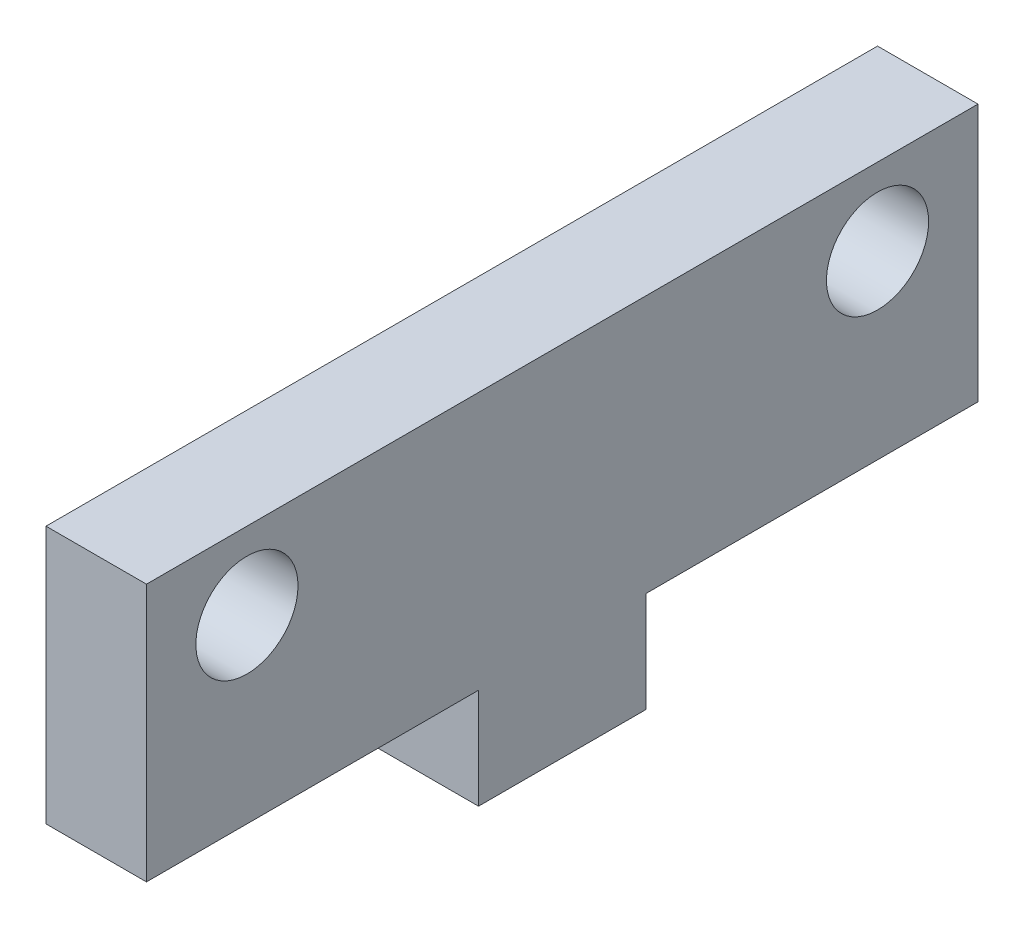
from build123d import *

# Parameters (mm, degrees)
SKETCH1_R           = 1.525
BOSS_EXTRUDE1_DEPTH = 3


with BuildPart() as part:
    # Sketch1 → Boss-Extrude1 (new body)
    with BuildSketch(Plane(origin=(0, 0, 0), x_dir=(0, 0, -1), z_dir=(1, 0, 0))):
        Polygon((0, 0), (-9.915, 0), (-9.915, -3), (-14.915, -3), (-14.915, 0), (-24.83, 0), (-24.83, 7.7), (0, 7.7), align=None)
        with Locations((-21.83, 5.4)):
            Circle(SKETCH1_R, mode=Mode.SUBTRACT)
        with Locations((-3, 5.4)):
            Circle(SKETCH1_R, mode=Mode.SUBTRACT)
    extrude(amount=BOSS_EXTRUDE1_DEPTH)


solid = part.part
